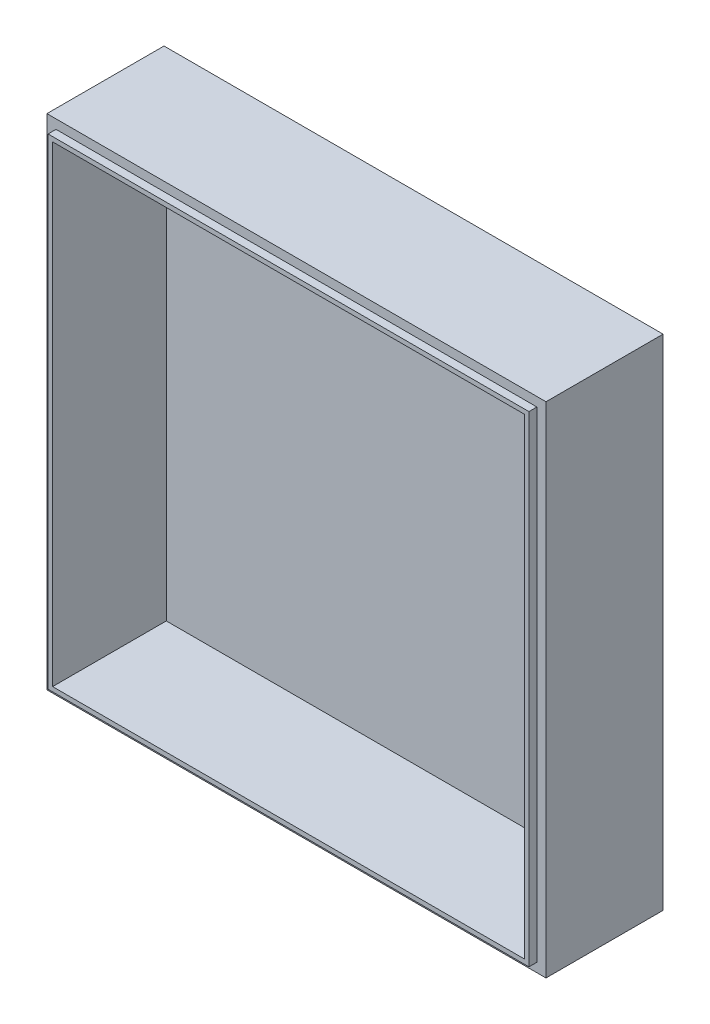
from build123d import *

# Parameters (mm, degrees)
SKETCH1_W           = 87.8
SKETCH1_H           = 87.8
BOSS_EXTRUDE1_DEPTH = 2
SKETCH1_3_W         = 87.8
SKETCH1_3_H         = 87.8
SKETCH1_3_W_2       = 83
SKETCH1_3_H_2       = 83
BOSS_EXTRUDE2_DEPTH = 20
SKETCH2_OUTSIDE_W   = 115.02
SKETCH2_OUTSIDE_H   = 115.02
SKETCH2_OUTSIDE_W_2 = 84.6
SKETCH2_OUTSIDE_H_2 = 84.6
CUT_EXTRUDE1_DEPTH  = 1.4


with BuildPart() as part:
    # Sketch1 → Boss-Extrude1 (new body)
    with BuildSketch(Plane.XY):
        with Locations((41.5, 41.5)):
            Rectangle(SKETCH1_W, SKETCH1_H)
    extrude(amount=-BOSS_EXTRUDE1_DEPTH)

    # Sketch1<3> → Boss-Extrude2 (add)
    with BuildSketch(Plane.XY):
        with Locations((41.5, 41.5)):
            Rectangle(SKETCH1_3_W, SKETCH1_3_H)
        with Locations((41.5, 41.5)):
            Rectangle(SKETCH1_3_W_2, SKETCH1_3_H_2, mode=Mode.SUBTRACT)
    extrude(amount=BOSS_EXTRUDE2_DEPTH)

    # Sketch2 outside → Cut-Extrude1 (cut)
    with BuildSketch(Plane.XY.offset(20)):
        with Locations((41.5, 41.5)):
            Rectangle(SKETCH2_OUTSIDE_W, SKETCH2_OUTSIDE_H)
        with Locations((41.5, 41.5)):
            Rectangle(SKETCH2_OUTSIDE_W_2, SKETCH2_OUTSIDE_H_2, mode=Mode.SUBTRACT)
    extrude(amount=-CUT_EXTRUDE1_DEPTH, mode=Mode.SUBTRACT)


solid = part.part
